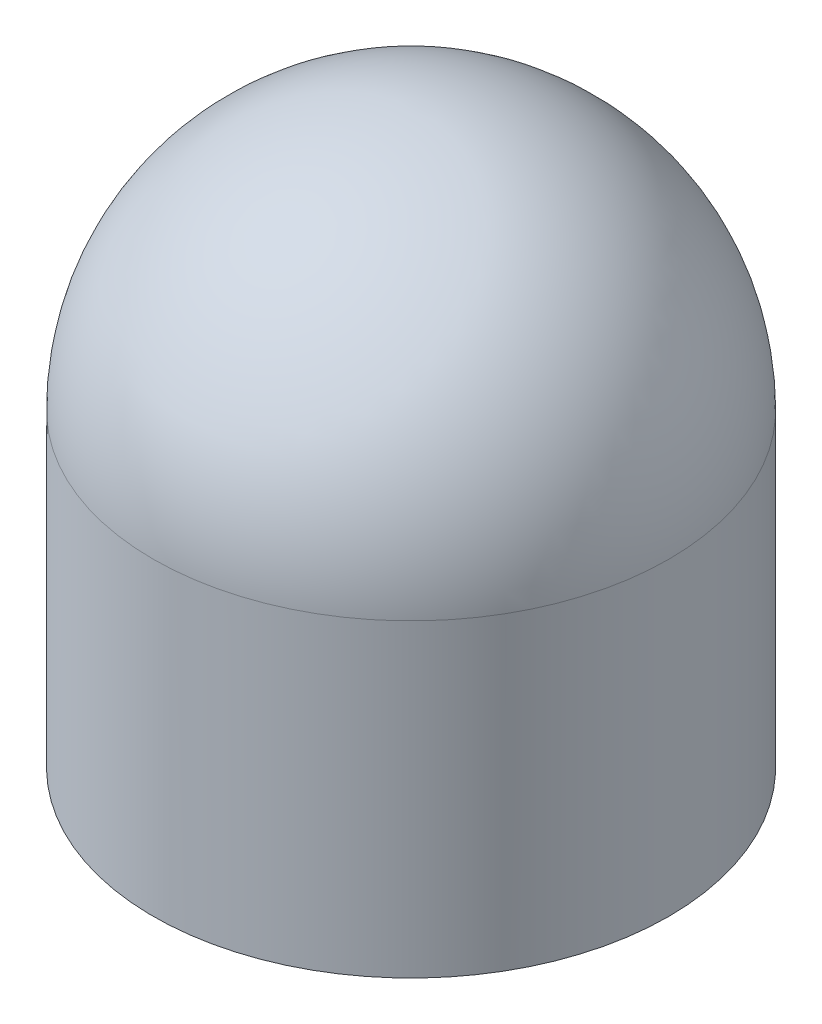
from build123d import *

# Parameters (mm, degrees)
SHELL1_T  = -0.1
SKETCH4_W = 5
SKETCH4_H = 6


with BuildPart() as part:
    # Sketch3 → Revolve1 (revolve)
    with BuildSketch(Plane.XY):
        with BuildLine():
            Line((0, 0), (5, 0))
            ThreePointArc((5, 0), (3.535533906, 3.535533906), (0, 5))
            Line((0, 5), (0, 0))
        make_face()
    revolve(axis=Axis((0, 0, 0), (0, 1, 0)))

    # Shell1
    shell1_openings = [part.faces().sort_by_distance(p)[0] for p in [
        (0, 0, 0),
    ]]
    offset(amount=SHELL1_T, openings=shell1_openings, kind=Kind.INTERSECTION)

    # Sketch4 → Revolve2 (revolve)
    with BuildSketch(Plane.XY):
        with Locations((2.5, -3)):
            Rectangle(SKETCH4_W, SKETCH4_H)
    revolve(axis=Axis((0, -6, 0), (0, 1, 0)))


solid = part.part
